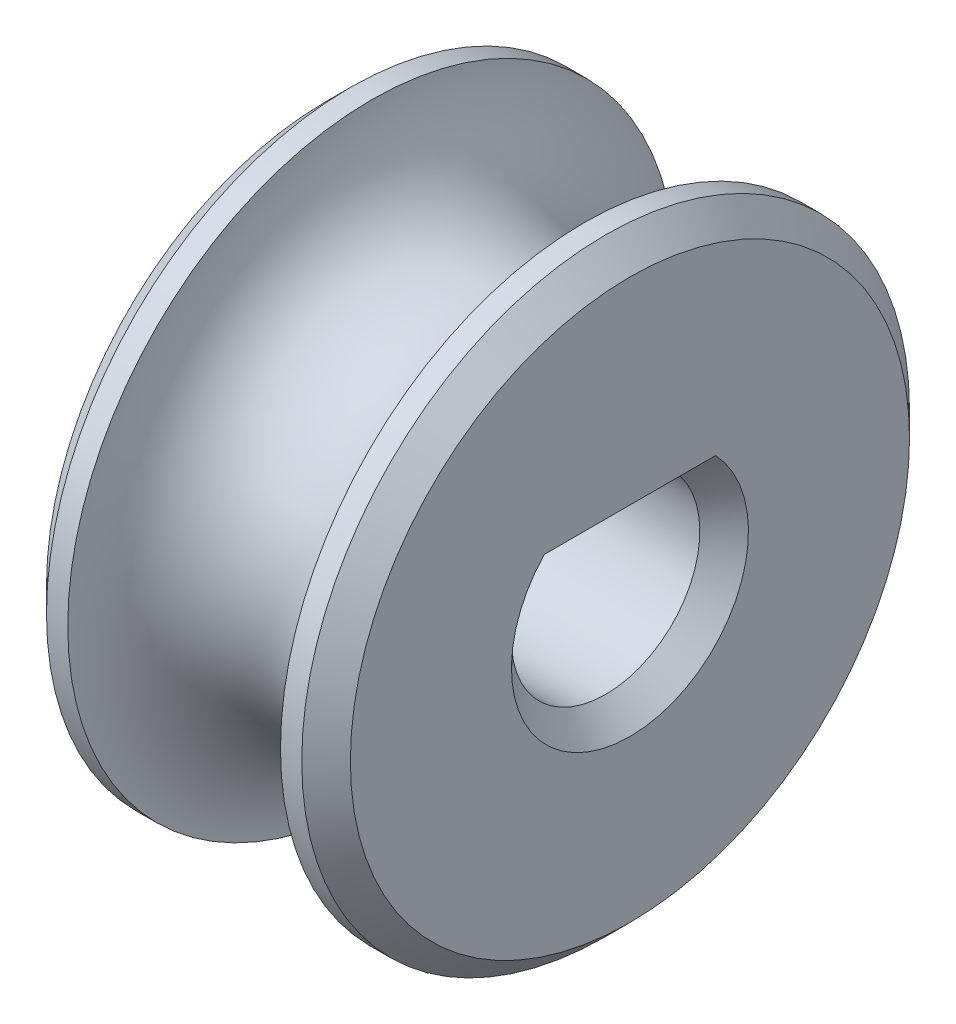
from build123d import *

# Parameters (mm, degrees)
CUT_EXTRUDE1_DEPTH = 11.307764064
CHAMFER1_SIZE      = 0.4


with BuildPart() as part:
    # Sketch1 → Revolve1 (revolve)
    with BuildSketch(Plane.XY, mode=Mode.PRIVATE) as revolve1_sk:
        with BuildLine():
            Line((1.75, 2.5), (2.5, 2.5))
            Line((2.5, 2.5), (2.5, -2.5))
            Line((2.5, -2.5), (-2.5, -2.5))
            Line((-2.5, -2.5), (-2.5, 2.5))
            Line((-2.5, 2.5), (-1.75, 2.5))
            ThreePointArc((-1.75, 2.5), (0, 0.75), (1.75, 2.5))
        make_face()
    revolve(revolve1_sk.sketch.rotate(Axis((-2.5, -2.5, 0), (1, 0, 0)), 90), axis=Axis((-2.5, -2.5, 0), (1, 0, 0)))

    # Sketch2 → Cut-Extrude1 (cut, through all)
    with BuildSketch(Plane(origin=(2.5, 0, 0), x_dir=(0, 0, -1), z_dir=(1, 0, 0))):
        with BuildLine():
            Line((-1.224744871, -1.55), (1.224744871, -1.55))
            ThreePointArc((1.224744871, -1.55), (0, -4.05), (-1.224744871, -1.55))
        make_face()
    extrude(amount=-CUT_EXTRUDE1_DEPTH, mode=Mode.SUBTRACT)

    # Chamfer1
    chamfer1_edges = [part.edges().sort_by_distance(p)[0] for p in [
        (-2.5, -4.05, 0),
        (-2.5, -1.55, 0),
        (2.5, -4.05, 0),
        (2.5, -1.55, 0),
        (-2.5, -2.5, -5),
        (2.5, -2.5, -5),
    ]]
    chamfer(chamfer1_edges, length=CHAMFER1_SIZE)


solid = part.part
